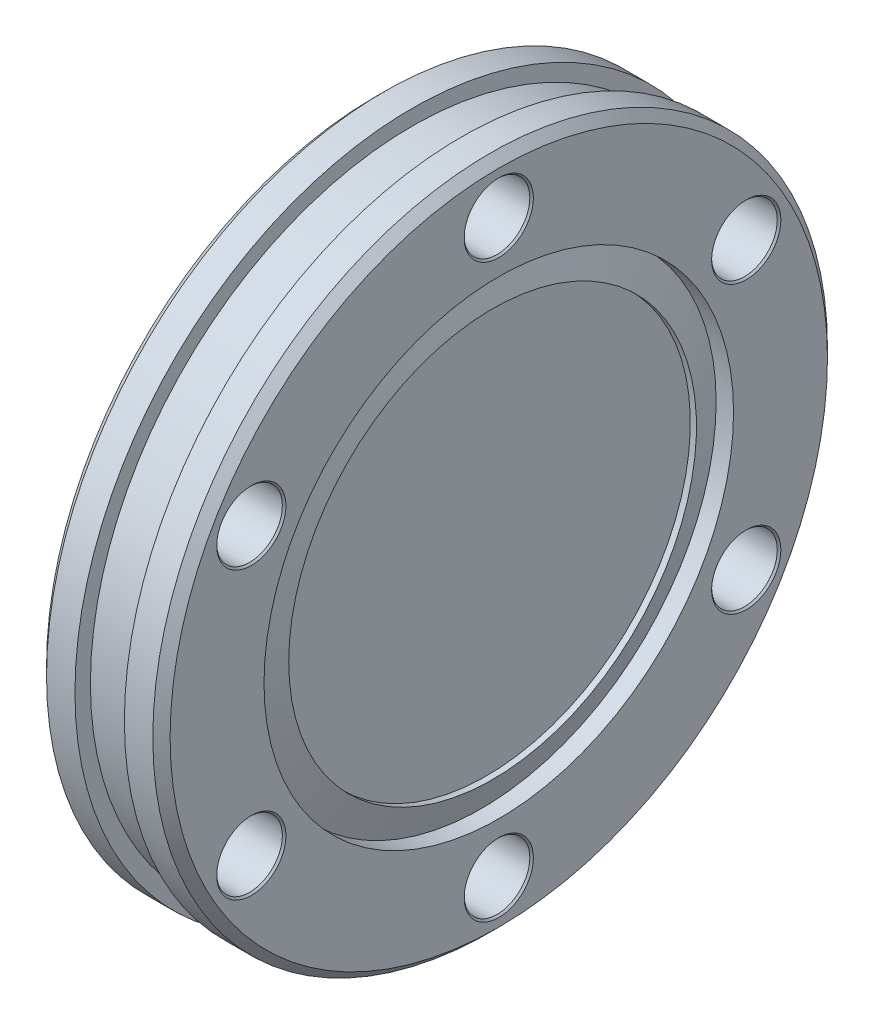
from build123d import *

# Parameters (mm, degrees)
M6_CLEARANCE_HOLE1_D = 6.74624
M6_CLEARANCE_HOLE2_D = 6.74624
CHAMFER1_SIZE        = 0.18288
CHAMFER2_SIZE        = 0.889


with BuildPart() as part:
    # Sketch1 → Revolve1 (revolve)
    with BuildSketch(Plane(origin=(0, 0, 0), x_dir=(-1, 0, 0), z_dir=(0, 0, -1)), mode=Mode.PRIVATE) as revolve1_sk:
        Polygon((-5.08, 20.955), (-5.08, 0), (6.35, 0), (6.35, 34.671), (2.54, 34.671), (2.54, 33.0835), (-2.54, 33.0835), (-2.54, 34.671), (-6.35, 34.671), (-6.35, 24.13), (-4.559394506, 24.13), (-5.715, 20.955), align=None)
    revolve(revolve1_sk.sketch.rotate(Axis((6.35, 0, 0), (-1, 0, 0)), 270), axis=Axis((6.35, 0, 0), (-1, 0, 0)))

    # M6 Clearance Hole1 (through all)
    with Locations(Plane(origin=(6.35, 0, 0), x_dir=(0, 0, -1), z_dir=(1, 0, 0))):
        with Locations((0, 29.36875), (25.434083577, 14.684375), (0, -29.36875), (-25.434083577, 14.684375)):
            Hole(M6_CLEARANCE_HOLE1_D / 2)

    # M6 Clearance Hole2 (through all)
    with Locations(Plane.ZY.offset(6.35)):
        with Locations((25.434083577, -14.684375), (-25.434083577, -14.684375)):
            Hole(M6_CLEARANCE_HOLE2_D / 2)

    # Chamfer1
    chamfer1_edges = [part.edges().sort_by_distance(p)[0] for p in [
        (6.35, 14.684375, 22.060963577),
        (-6.35, 14.684375, 22.060963577),
        (6.35, -29.36875, -3.37312),
        (-6.35, -29.36875, -3.37312),
        (6.35, 14.684375, -28.807203577),
        (-6.35, 14.684375, -28.807203577),
        (6.35, 29.36875, -3.37312),
        (-6.35, 29.36875, -3.37312),
        (-6.35, -14.684375, -22.060963577),
        (6.35, -14.684375, -22.060963577),
        (-6.35, -14.684375, 28.807203577),
        (6.35, -14.684375, 28.807203577),
    ]]
    chamfer(chamfer1_edges, length=CHAMFER1_SIZE)

    # Chamfer2
    chamfer2_edges = [part.edges().sort_by_distance(p)[0] for p in [
        (6.35, 0, -34.671),
        (-6.35, 0, -34.671),
    ]]
    chamfer(chamfer2_edges, length=CHAMFER2_SIZE)


solid = part.part
